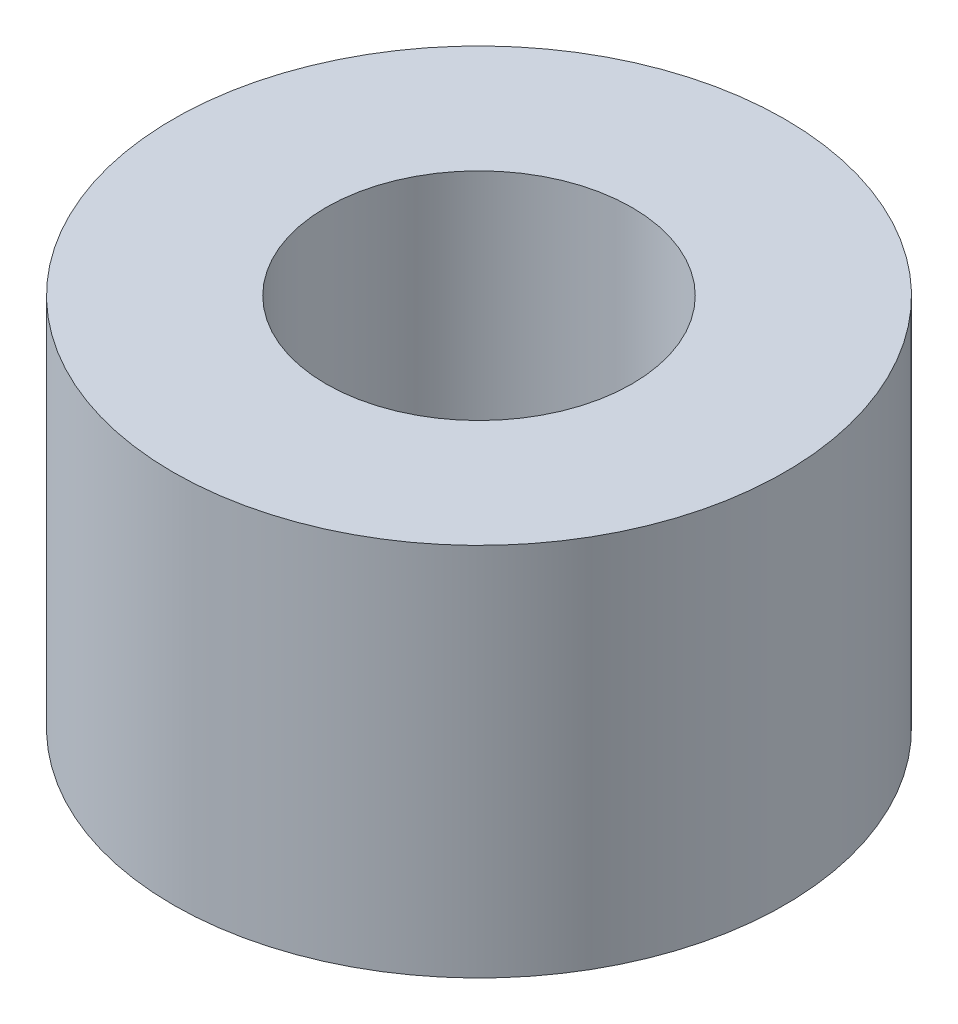
from build123d import *

# Parameters (mm, degrees)
SKETCH1_R           = 25.4
BOSS_EXTRUDE1_DEPTH = 31.115
SKETCH2_R           = 12.7
CUT_EXTRUDE1_DEPTH  = 48.523291395


with BuildPart() as part:
    # Sketch1 → Boss-Extrude1 (new body)
    with BuildSketch(Plane(origin=(0, 0, 0), x_dir=(1, 0, 0), z_dir=(0, 1, 0))):
        with Locations(Location((0, 0, 0), (0, 0, 90))):
            Circle(SKETCH1_R)
    extrude(amount=BOSS_EXTRUDE1_DEPTH)

    # Sketch2 → Cut-Extrude1 (cut, through all)
    with BuildSketch(Plane(origin=(0, 31.115, 0), x_dir=(1, 0, 0), z_dir=(0, 1, 0))):
        with Locations(Location((0, 0, 0), (0, 0, 270))):
            Circle(SKETCH2_R)
    extrude(amount=-CUT_EXTRUDE1_DEPTH, mode=Mode.SUBTRACT)


solid = part.part
